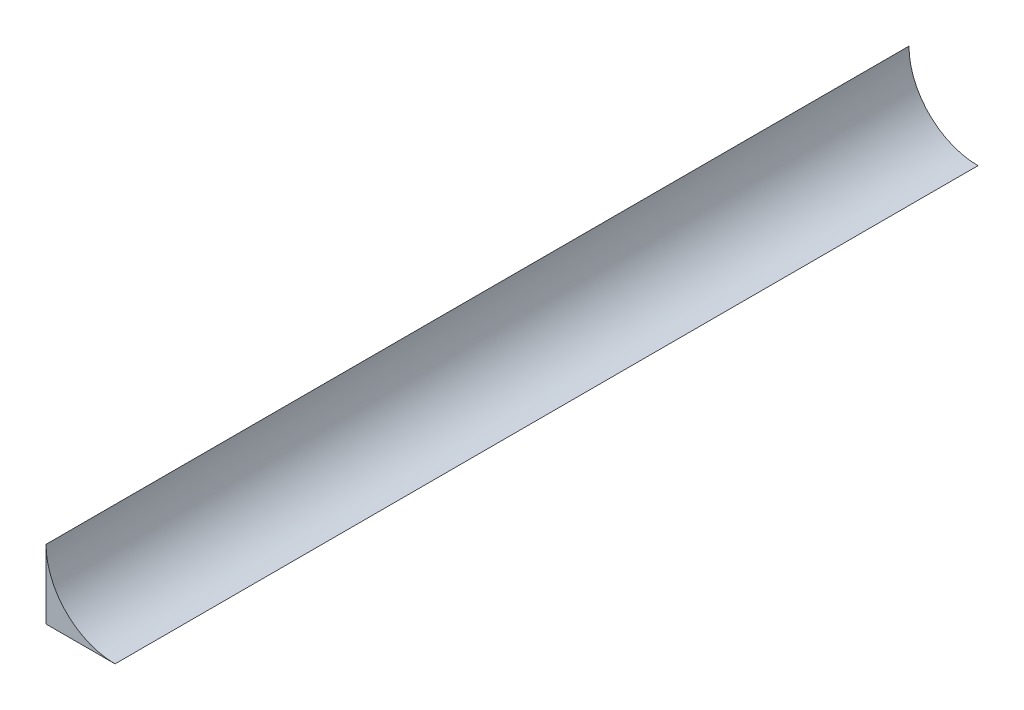
from build123d import *

# Parameters (mm, degrees)
BOSS_EXTRUDE1_DEPTH = 79.375


with BuildPart() as part:
    # Sketch1 → Boss-Extrude1 (new, symmetric)
    with BuildSketch(Plane.XY):
        with BuildLine():
            Line((0, 12.7), (0, 0))
            Line((0, 0), (12.7, 0))
            ThreePointArc((12.7, 0), (3.719743879, 3.719743879), (0, 12.7))
        make_face()
    extrude(amount=BOSS_EXTRUDE1_DEPTH, both=True)


solid = part.part
